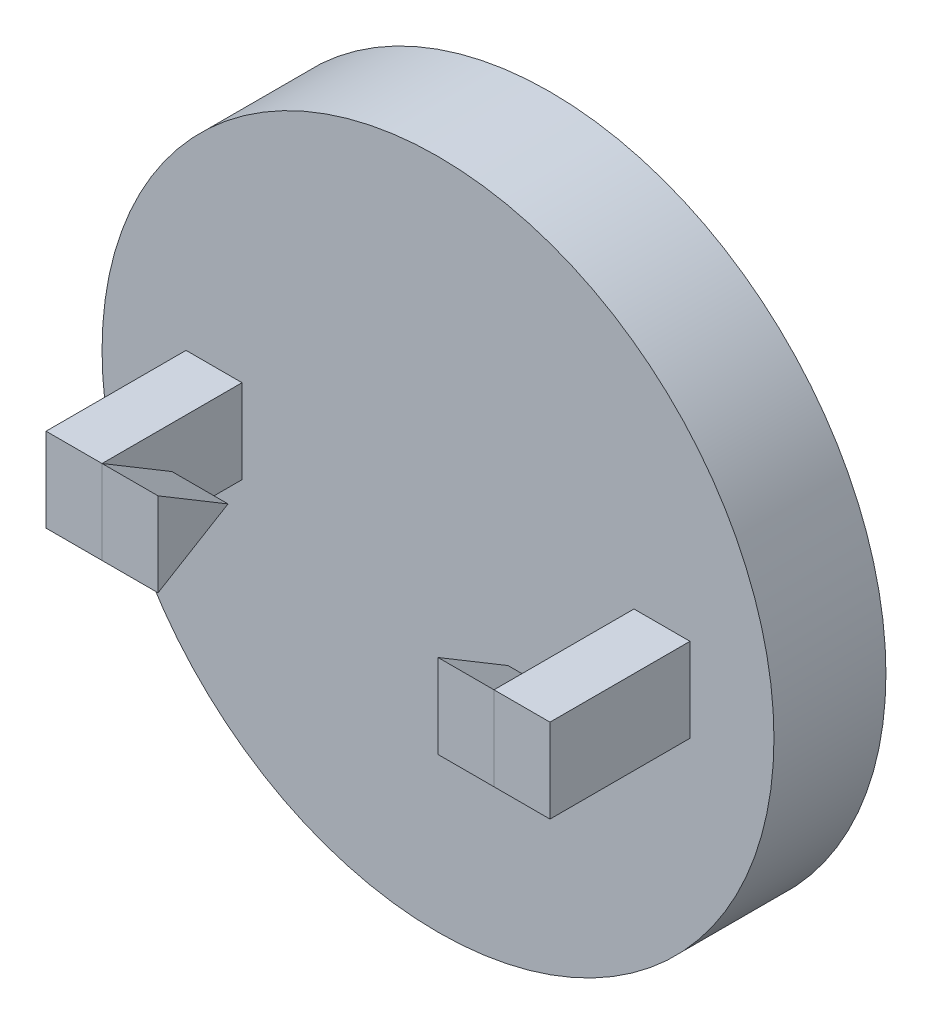
from build123d import *

# Parameters (mm, degrees)
SKETCH_1_R      = 60
EXTRUDE_1_DEPTH = 10
SKETCH_2_W      = 10
SKETCH_2_H      = 15
EXTRUDE_2_DEPTH = 25
EXTRUDE_3_DEPTH = 10


with BuildPart() as part:
    # 草图1 → 凸台-拉伸1 (new, symmetric)
    with BuildSketch(Plane.XY):
        Circle(SKETCH_1_R)
    extrude(amount=EXTRUDE_1_DEPTH, both=True)


with BuildPart() as body_2:
    # 草图2 → 凸台-拉伸2 (new body)
    with BuildSketch(Plane.XY.offset(10)):
        with Locations((-40, 0)):
            Rectangle(SKETCH_2_W, SKETCH_2_H)
    extrude(amount=EXTRUDE_2_DEPTH)


with BuildPart() as body_3:
    # 草图4 → 凸台-拉伸3 (new body)
    with BuildSketch(Plane(origin=(-35, 0, 0), x_dir=(0, 0, -1), z_dir=(1, 0, 0))):
        Polygon((-35, 7.5), (-22.5, 0), (-35, -7.5), align=None)
    extrude(amount=EXTRUDE_3_DEPTH)


with BuildPart() as body_4:
    # 镜向1: mirrored copy
    add(body_3.part.mirror(Plane(origin=(0, 0, 0), x_dir=(0, 0, 1), z_dir=(1, 0, 0))))


with BuildPart() as body_5:
    # Mirror 1 2: mirrored copy
    add(body_2.part.mirror(Plane(origin=(0, 0, 0), x_dir=(0, 0, 1), z_dir=(1, 0, 0))))


solid = Compound([part.part, body_2.part, body_3.part, body_4.part, body_5.part])
